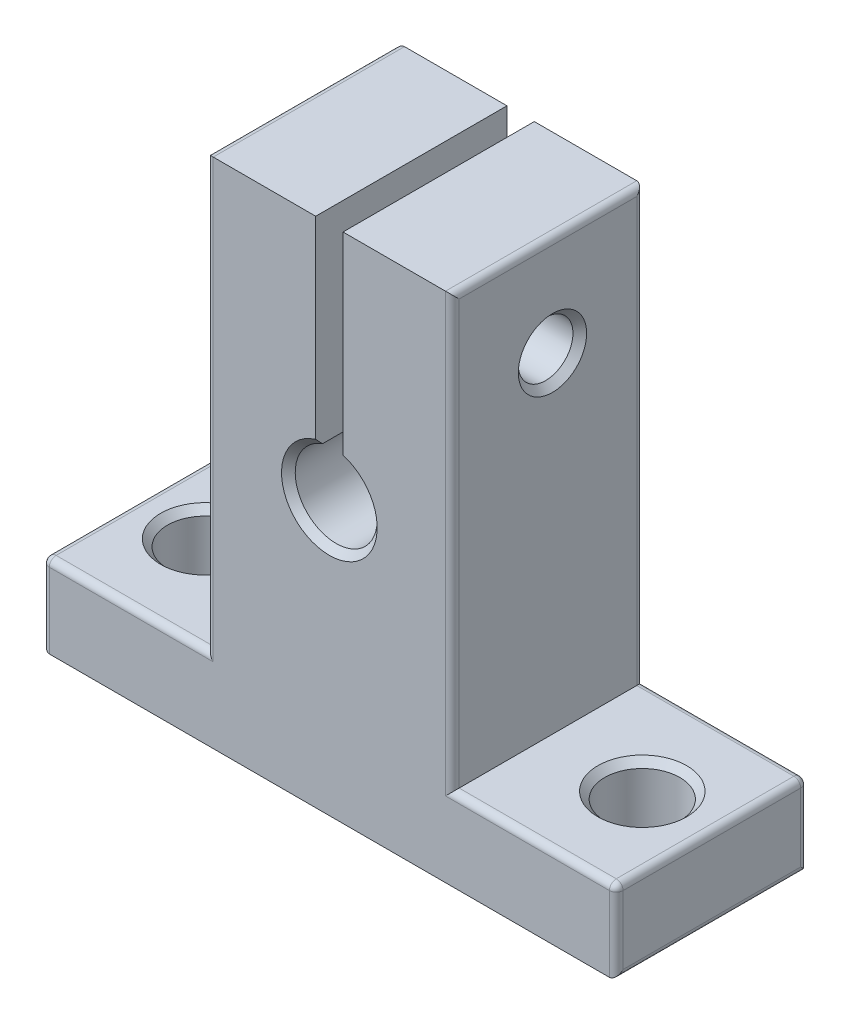
from build123d import *

# Parameters (mm, degrees)
BOSS_EXTRUDE1_DEPTH     = 7
SKETCH2_R               = 2.75
CUT_EXTRUDE1_DEPTH      = 39.5
CUT_EXTRUDE2_DEPTH      = 42.512046444
CUT_EXTRUDE2_DEPTH_BACK = 42.512046444
SKETCH5_R               = 2
CHAMFER2_SIZE           = 0.5
FILLET2_R               = 0.5


with BuildPart() as part:
    # Sketch1 → Boss-Extrude1 (new, symmetric)
    with BuildSketch(Plane.XY):
        with BuildLine():
            Line((-21, -3), (-21, 3))
            Line((-21, 3), (-9, 3))
            Line((-9, 3), (-9, 34.5))
            Line((-9, 34.5), (-1, 34.5))
            Line((-1, 34.5), (-1, 19.828427125))
            ThreePointArc((-1, 19.828427125), (0, 14), (1, 19.828427125))
            Line((1, 19.828427125), (1, 34.5))
            Line((1, 34.5), (9, 34.5))
            Line((9, 34.5), (9, 3))
            Line((9, 3), (21, 3))
            Line((21, 3), (21, -3))
            Line((21, -3), (-21, -3))
        make_face()
    extrude(amount=BOSS_EXTRUDE1_DEPTH, both=True)

    # Sketch2 → Cut-Extrude1 (cut, through all)
    with BuildSketch(Plane(origin=(0, 3, 0), x_dir=(1, 0, 0), z_dir=(0, 1, 0))):
        with Locations(Location((15.904501915, 0, 0), (0, 0, 180))):
            Circle(SKETCH2_R)
        with Locations((-16.095498085, 0)):
            Circle(SKETCH2_R)
    extrude(amount=-CUT_EXTRUDE1_DEPTH, mode=Mode.SUBTRACT)

    # Sketch5 → Cut-Extrude2 (cut, two sides: drawn at the far end of the back side and taken through both)
    with BuildSketch(Plane(origin=(-1, 0, 0), x_dir=(0, 0, -1), z_dir=(1, 0, 0)).offset(-CUT_EXTRUDE2_DEPTH_BACK)):
        with Locations((0.330734984, 27.164213562)):
            Circle(SKETCH5_R)
    extrude(amount=CUT_EXTRUDE2_DEPTH + CUT_EXTRUDE2_DEPTH_BACK, mode=Mode.SUBTRACT)

    # Chamfer2
    chamfer2_edges = [part.edges().sort_by_distance(p)[0] for p in [
        (0, 14, -7),
        (0, 14, 7),
        (18.654501915, 3, 0),
        (-18.845498085, 3, 0),
        (-9, 27.164213562, 1.669265016),
        (9, 27.164213562, 1.669265016),
    ]]
    chamfer(chamfer2_edges, length=CHAMFER2_SIZE)

    # Fillet2
    fillet2_edges = [part.edges().sort_by_distance(p)[0] for p in [
        (-15, 3, 7),
        (9, 18.75, -7),
        (15, 3, -7),
        (-21, 0, 7),
        (21, 0, -7),
        (-21, 0, -7),
        (-15, 3, -7),
        (-9, 18.75, -7),
        (21, 0, 7),
        (9, 34.5, 0),
        (21, 3, 0),
        (21, -3, 0),
        (-21, -3, 0),
        (-21, 3, 0),
        (-9, 34.5, 0),
        (15, 3, 7),
        (9, 18.75, 7),
        (-9, 18.75, 7),
    ]]
    fillet(fillet2_edges, radius=FILLET2_R)


solid = part.part
